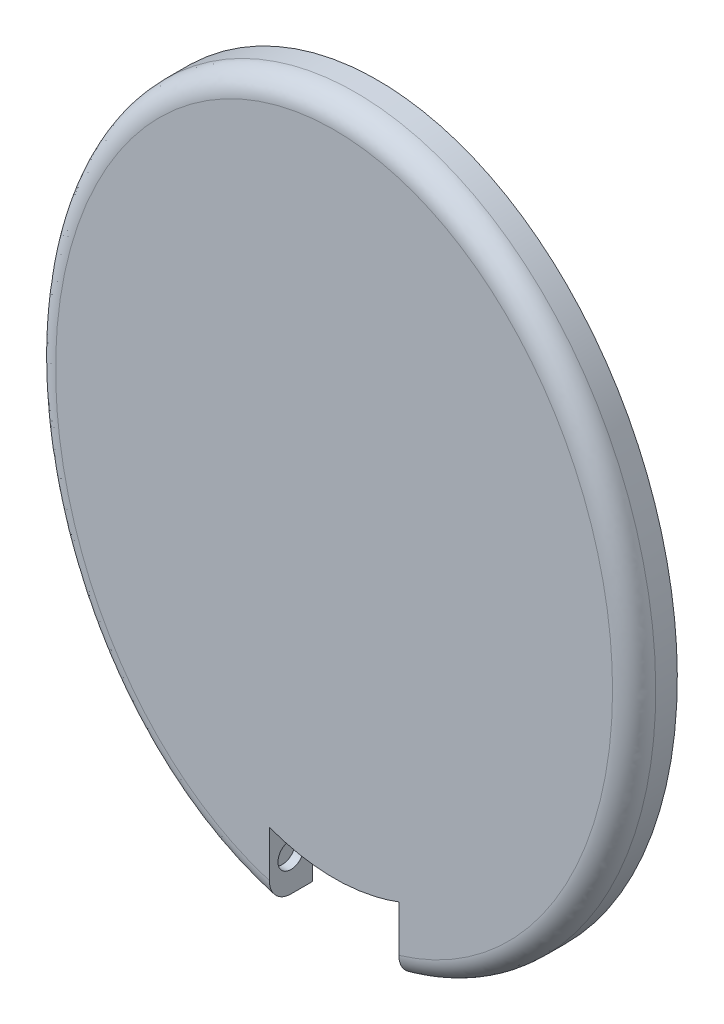
from build123d import *

# Parameters (mm, degrees)
SKETCH2_RX              = 85.154239152
SKETCH2_RY              = 69.502968375
SKETCH2_RX_2            = 70
SKETCH2_RY_2            = 53.954429773
BOSS_EXTRUDE2_DEPTH     = 10
SKETCH5_W               = 30
SKETCH5_H               = 10
CUT_EXTRUDE4_DEPTH      = 198
SKETCH7_RX              = 70
SKETCH7_RY              = 53.954429773
BOSS_EXTRUDE4_DEPTH     = 10
FILLET3_R               = 5
CUT_EXTRUDE5_DEPTH      = 32
CUT_EXTRUDE5_DEPTH_BACK = 2
SKETCH8_R               = 3


with BuildPart() as part:
    # Sketch2 → Boss-Extrude2 (new body)
    with BuildSketch(Plane.XY):
        with Locations(Location((0, 0), (0, 0, -90))):
            Ellipse(SKETCH2_RX, SKETCH2_RY)
        with Locations(Location((0, 0), (0, 0, -90))):
            Ellipse(SKETCH2_RX_2, SKETCH2_RY_2, mode=Mode.SUBTRACT)
    extrude(amount=BOSS_EXTRUDE2_DEPTH)

    # Sketch5 → Cut-Extrude4 (cut)
    with BuildSketch(Plane(origin=(0, 0, 0), x_dir=(1, 0, 0), z_dir=(0, 1, 0))):
        with Locations((0, -5)):
            Rectangle(SKETCH5_W, SKETCH5_H)
    extrude(amount=-CUT_EXTRUDE4_DEPTH, mode=Mode.SUBTRACT)

    # Sketch7 → Boss-Extrude4 (add)
    with BuildSketch(Plane.XY.offset(10)):
        with Locations(Location((0, 0), (0, 0, -90))):
            Ellipse(SKETCH7_RX, SKETCH7_RY)
    extrude(amount=-BOSS_EXTRUDE4_DEPTH)

    # Fillet3
    fillet3_edges = [part.edges().sort_by_distance(p)[0] for p in [
        (-0.004276398, 85.154238991, 10),
    ]]
    fillet(fillet3_edges, radius=FILLET3_R)

    # Sketch8 → Cut-Extrude5 (cut, two sides: drawn at the far end of the back side and taken through both)
    with BuildSketch(Plane(origin=(-15, 0, 0), x_dir=(0, 0, -1), z_dir=(1, 0, 0)).offset(-CUT_EXTRUDE5_DEPTH_BACK)):
        with Locations((-5, -75.24042417)):
            Circle(SKETCH8_R)
    extrude(amount=CUT_EXTRUDE5_DEPTH + CUT_EXTRUDE5_DEPTH_BACK, mode=Mode.SUBTRACT)


solid = part.part
